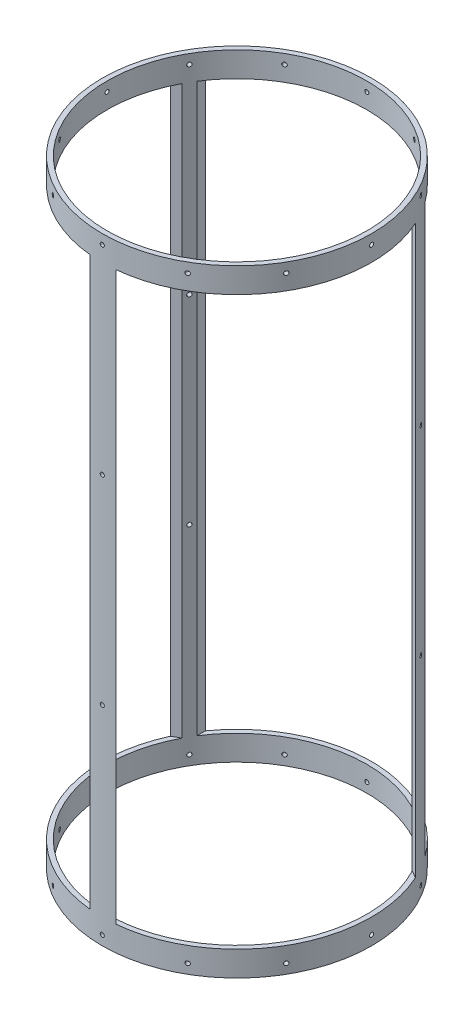
from build123d import *

# Parameters (mm, degrees)
SKETCH1_R                = 88.9
SKETCH1_R_2              = 85.725
BOSS_EXTRUDE1_DEPTH      = 203.581
CUT_EXTRUDE1_REACH       = 241.273
CUT_EXTRUDE1_END_RADIUS  = 88.9
SKETCH2_W                = 144.78
SKETCH2_H                = 374.142
CIRPATTERN1_COUNT        = 3
SKETCH4_R                = 1.35255
CUT_EXTRUDE3_DEPTH       = 15.24
CIRPATTERN3_COUNT        = 12
MIRROR1_COPY_1_SKETCH_R  = 1.35255
MIRROR1_COPY_1_DEPTH     = 15.24
MIRROR1_COPY_2_SKETCH_R  = 1.35255
MIRROR1_COPY_2_DEPTH     = 15.24
MIRROR1_COPY_3_SKETCH_R  = 1.35255
MIRROR1_COPY_3_DEPTH     = 15.24
MIRROR1_COPY_4_SKETCH_R  = 1.35255
MIRROR1_COPY_4_DEPTH     = 15.24
MIRROR1_COPY_5_SKETCH_R  = 1.35255
MIRROR1_COPY_5_DEPTH     = 15.24
MIRROR1_COPY_6_SKETCH_R  = 1.35255
MIRROR1_COPY_6_DEPTH     = 15.24
MIRROR1_COPY_7_SKETCH_R  = 1.35255
MIRROR1_COPY_7_DEPTH     = 15.24
MIRROR1_COPY_8_SKETCH_R  = 1.35255
MIRROR1_COPY_8_DEPTH     = 15.24
MIRROR1_COPY_9_SKETCH_R  = 1.35255
MIRROR1_COPY_9_DEPTH     = 15.24
MIRROR1_COPY_10_SKETCH_R = 1.35255
MIRROR1_COPY_10_DEPTH    = 15.24
MIRROR1_COPY_11_SKETCH_R = 1.35255
MIRROR1_COPY_11_DEPTH    = 15.24
SKETCH5_R                = 1.35255
CUT_EXTRUDE4_DEPTH       = 46.482
CIRPATTERN4_COUNT        = 3


with BuildPart() as part:
    # Sketch1 → Boss-Extrude1 (new, symmetric)
    with BuildSketch(Plane(origin=(0, 0, 0), x_dir=(1, 0, 0), z_dir=(0, 1, 0))):
        with Locations(Location((0, 0, 0), (0, 0, 270))):
            Circle(SKETCH1_R)
        with Locations(Location((0, 0, 0), (0, 0, 270))):
            Circle(SKETCH1_R_2, mode=Mode.SUBTRACT)
    extrude(amount=BOSS_EXTRUDE1_DEPTH, both=True)

    # Cut-Extrude1: up to this cylinder (the profile starts inside it)
    cut_extrude1_end = Plane(origin=(0, 0, 0), z_dir=(0, -1, 0)) * Cylinder(CUT_EXTRUDE1_END_RADIUS, 661.346, mode=Mode.PRIVATE)
    # Sketch2 → Cut-Extrude1 (cut, up to the surface)
    with BuildSketch(Plane.XY, mode=Mode.PRIVATE) as cut_extrude1_sk1:
        Rectangle(SKETCH2_W, SKETCH2_H)
    cut_extrude1_tool1 = extrude(cut_extrude1_sk1.sketch, amount=-CUT_EXTRUDE1_REACH, mode=Mode.PRIVATE) & cut_extrude1_end
    cut_extrude1 = cut_extrude1_tool1.solids().sort_by_distance((0, 0, 0))[0]
    add(cut_extrude1, mode=Mode.SUBTRACT)

    # CirPattern1: Cut-Extrude1 ×3 about axis
    cirpattern1_axis = Axis((0, 0, 0), (0, 1, 0))
    for i in range(1, CIRPATTERN1_COUNT):
        add(cut_extrude1.rotate(cirpattern1_axis, i * 360 / CIRPATTERN1_COUNT), mode=Mode.SUBTRACT)

    # Sketch4 → Cut-Extrude3 (cut)
    with BuildSketch(Plane(origin=(88.9, 0, 0), x_dir=(0, 0, -1), z_dir=(1, 0, 0))):
        with Locations((0, 197.231)):
            Circle(SKETCH4_R)
    cut_extrude3 = extrude(amount=-CUT_EXTRUDE3_DEPTH, mode=Mode.SUBTRACT)

    # CirPattern3: Cut-Extrude3 ×12 about axis
    cirpattern3_axis = Axis((0, 203.581, 0), (0, -1, 0))
    for i in range(1, CIRPATTERN3_COUNT):
        add(cut_extrude3.rotate(cirpattern3_axis, i * 360 / CIRPATTERN3_COUNT), mode=Mode.SUBTRACT)

    # Mirror1: Cut-Extrude3 across plane
    add(cut_extrude3.mirror(Plane.ZX), mode=Mode.SUBTRACT)

    # Mirror1 copy 1 sketch → Mirror1 copy 1 (cut)
    with BuildSketch(Plane(origin=(76.989658396, 0, 44.45), x_dir=(0.49999999999999994, 0, -0.8660254037844387), z_dir=(0.8660254037844387, 0, 0.49999999999999994))):
        with Locations((0, -197.231)):
            Circle(MIRROR1_COPY_1_SKETCH_R)
    extrude(amount=-MIRROR1_COPY_1_DEPTH, mode=Mode.SUBTRACT)

    # Mirror1 copy 2 sketch → Mirror1 copy 2 (cut)
    with BuildSketch(Plane(origin=(44.45, 0, 76.989658396), x_dir=(0.8660254037844386, 0, -0.5000000000000001), z_dir=(0.5000000000000001, 0, 0.8660254037844386))):
        with Locations((0, -197.231)):
            Circle(MIRROR1_COPY_2_SKETCH_R)
    extrude(amount=-MIRROR1_COPY_2_DEPTH, mode=Mode.SUBTRACT)

    # Mirror1 copy 3 sketch → Mirror1 copy 3 (cut)
    with BuildSketch(Plane.XY.offset(88.9)):
        with Locations((0, -197.231)):
            Circle(MIRROR1_COPY_3_SKETCH_R)
    extrude(amount=-MIRROR1_COPY_3_DEPTH, mode=Mode.SUBTRACT)

    # Mirror1 copy 4 sketch → Mirror1 copy 4 (cut)
    with BuildSketch(Plane(origin=(-44.45, 0, 76.989658396), x_dir=(0.8660254037844387, 0, 0.4999999999999998), z_dir=(-0.4999999999999998, 0, 0.8660254037844387))):
        with Locations((0, -197.231)):
            Circle(MIRROR1_COPY_4_SKETCH_R)
    extrude(amount=-MIRROR1_COPY_4_DEPTH, mode=Mode.SUBTRACT)

    # Mirror1 copy 5 sketch → Mirror1 copy 5 (cut)
    with BuildSketch(Plane(origin=(-76.989658396, 0, 44.45), x_dir=(0.49999999999999994, 0, 0.8660254037844387), z_dir=(-0.8660254037844387, 0, 0.49999999999999994))):
        with Locations((0, -197.231)):
            Circle(MIRROR1_COPY_5_SKETCH_R)
    extrude(amount=-MIRROR1_COPY_5_DEPTH, mode=Mode.SUBTRACT)

    # Mirror1 copy 6 sketch → Mirror1 copy 6 (cut)
    with BuildSketch(Plane.ZY.offset(88.9)):
        with Locations((0, -197.231)):
            Circle(MIRROR1_COPY_6_SKETCH_R)
    extrude(amount=-MIRROR1_COPY_6_DEPTH, mode=Mode.SUBTRACT)

    # Mirror1 copy 7 sketch → Mirror1 copy 7 (cut)
    with BuildSketch(Plane(origin=(-76.989658396, 0, -44.45), x_dir=(-0.5000000000000001, 0, 0.8660254037844386), z_dir=(-0.8660254037844386, 0, -0.5000000000000001))):
        with Locations((0, -197.231)):
            Circle(MIRROR1_COPY_7_SKETCH_R)
    extrude(amount=-MIRROR1_COPY_7_DEPTH, mode=Mode.SUBTRACT)

    # Mirror1 copy 8 sketch → Mirror1 copy 8 (cut)
    with BuildSketch(Plane(origin=(-44.45, 0, -76.989658396), x_dir=(-0.8660254037844384, 0, 0.5000000000000004), z_dir=(-0.5000000000000004, 0, -0.8660254037844384))):
        with Locations((0, -197.231)):
            Circle(MIRROR1_COPY_8_SKETCH_R)
    extrude(amount=-MIRROR1_COPY_8_DEPTH, mode=Mode.SUBTRACT)

    # Mirror1 copy 9 sketch → Mirror1 copy 9 (cut)
    with BuildSketch(Plane(origin=(0, 0, -88.9), x_dir=(-1, 0, 0), z_dir=(0, 0, -1))):
        with Locations((0, -197.231)):
            Circle(MIRROR1_COPY_9_SKETCH_R)
    extrude(amount=-MIRROR1_COPY_9_DEPTH, mode=Mode.SUBTRACT)

    # Mirror1 copy 10 sketch → Mirror1 copy 10 (cut)
    with BuildSketch(Plane(origin=(44.45, 0, -76.989658396), x_dir=(-0.8660254037844386, 0, -0.5000000000000001), z_dir=(0.5000000000000001, 0, -0.8660254037844386))):
        with Locations((0, -197.231)):
            Circle(MIRROR1_COPY_10_SKETCH_R)
    extrude(amount=-MIRROR1_COPY_10_DEPTH, mode=Mode.SUBTRACT)

    # Mirror1 copy 11 sketch → Mirror1 copy 11 (cut)
    with BuildSketch(Plane(origin=(76.989658396, 0, -44.45), x_dir=(-0.5000000000000004, 0, -0.8660254037844384), z_dir=(0.8660254037844384, 0, -0.5000000000000004))):
        with Locations((0, -197.231)):
            Circle(MIRROR1_COPY_11_SKETCH_R)
    extrude(amount=-MIRROR1_COPY_11_DEPTH, mode=Mode.SUBTRACT)

    # Sketch5 → Cut-Extrude4 (cut)
    with BuildSketch(Plane.XY.offset(88.9)):
        with Locations((0, -65.7606)):
            Circle(SKETCH5_R)
        with Locations((0, 65.7606)):
            Circle(SKETCH5_R)
    cut_extrude4 = extrude(amount=-CUT_EXTRUDE4_DEPTH, mode=Mode.SUBTRACT)

    # CirPattern4: Cut-Extrude4 ×3 about axis
    cirpattern4_axis = Axis((0, 203.581, 0), (0, -1, 0))
    for i in range(1, CIRPATTERN4_COUNT):
        add(cut_extrude4.rotate(cirpattern4_axis, i * 360 / CIRPATTERN4_COUNT), mode=Mode.SUBTRACT)


solid = part.part
